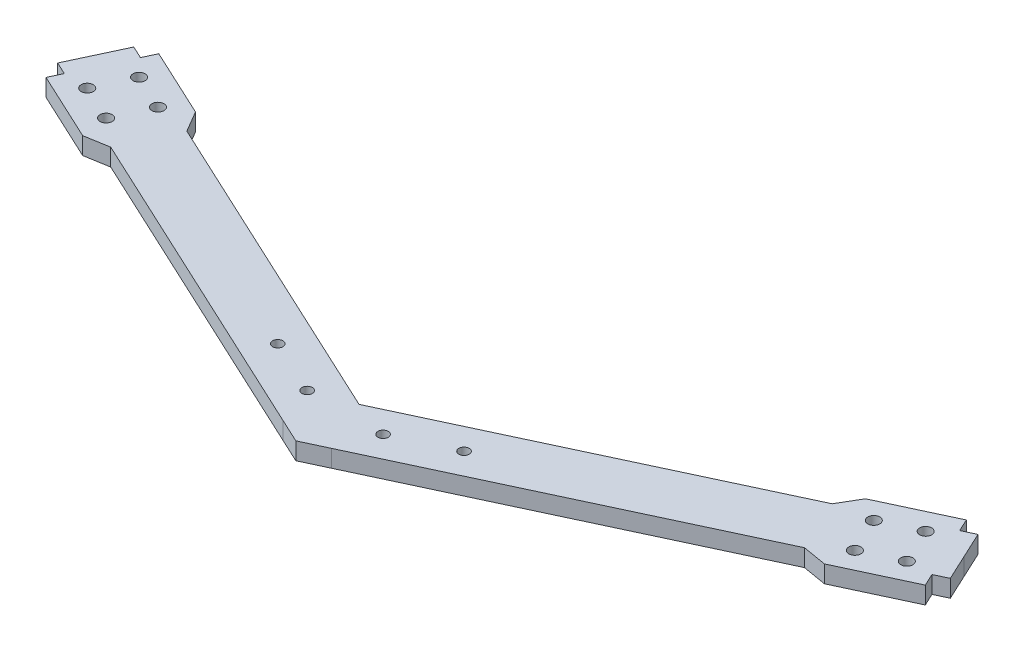
from build123d import *

# Parameters (mm, degrees)
BOSS_EXTRUDE1_DEPTH = 2.5
SKETCH2_R           = 1.5
CUT_EXTRUDE1_DEPTH  = 151.793609014
SKETCH3_R           = 1.75
CUT_EXTRUDE2_DEPTH  = 151.793609014


with BuildPart() as part:
    # Sketch1 → Boss-Extrude1 (new, symmetric)
    with BuildSketch(Plane(origin=(0, 0, 0), x_dir=(1, 0, 0), z_dir=(0, 1, 0))):
        Polygon((0, 18.32), (-93.530963622, 61.934204612), (-97.099562891, 68.014303234), (-117.038334206, 77.311904992), (-118.728807253, 73.686673844), (-122.354038401, 75.377146891), (-125.861769973, 67.854792259), (-129.369941895, 60.33264298), (-125.744809712, 58.641957717), (-127.435494976, 55.016825534), (-107.497267972, 45.718056586), (-100.545722072, 46.892156069), (-7.017311764, 3.272476275), (0, 0), (7.017311764, 3.272476275), (100.545722072, 46.892156069), (107.497267972, 45.718056586), (127.435494976, 55.016825534), (125.744809712, 58.641957717), (129.369941895, 60.33264298), (125.861769973, 67.854792259), (122.354038401, 75.377146891), (118.728807253, 73.686673844), (117.038334206, 77.311904992), (97.099562891, 68.014303234), (93.530963622, 61.934204612), align=None)
    extrude(amount=BOSS_EXTRUDE1_DEPTH, both=True)

    # Sketch2 → Cut-Extrude1 (cut, through all)
    with BuildSketch(Plane(origin=(0, 2.5, 0), x_dir=(1, 0, 0), z_dir=(0, 1, 0))):
        with Locations(Location((-11, 14.291347512, 0), (0, 0, 270))):
            Circle(SKETCH2_R)
        with Locations(Location((11, 14.291347512, 0), (0, 0, 270))):
            Circle(SKETCH2_R)
        with Locations(Location((-27, 21.752270043, 0), (0, 0, 270))):
            Circle(SKETCH2_R)
        with Locations(Location((27, 21.752270043, 0), (0, 0, 90))):
            Circle(SKETCH2_R)
    extrude(amount=-CUT_EXTRUDE1_DEPTH, mode=Mode.SUBTRACT)

    # Sketch3 → Cut-Extrude2 (cut, through all)
    with BuildSketch(Plane(origin=(0, 2.5, 0), x_dir=(1, 0, 0), z_dir=(0, 1, 0))):
        with Locations(Location((-114.001493892, 68.562429851, 0), (0, 0, 270))):
            Circle(SKETCH3_R)
        with Locations(Location((-118.780213306, 58.314432997, 0), (0, 0, 270))):
            Circle(SKETCH3_R)
        with Locations(Location((-103.742089693, 63.778391104, 0), (0, 0, 270))):
            Circle(SKETCH3_R)
        with Locations(Location((-108.521689093, 53.530073465, 0), (0, 0, 270))):
            Circle(SKETCH3_R)
        with Locations(Location((103.742089693, 63.778391104, 0), (0, 0, 90))):
            Circle(SKETCH3_R)
        with Locations(Location((108.521689093, 53.530073465, 0), (0, 0, 90))):
            Circle(SKETCH3_R)
        with Locations(Location((118.780213306, 58.314432997, 0), (0, 0, 90))):
            Circle(SKETCH3_R)
        with Locations(Location((114.001493892, 68.562429851, 0), (0, 0, 90))):
            Circle(SKETCH3_R)
    extrude(amount=-CUT_EXTRUDE2_DEPTH, mode=Mode.SUBTRACT)


solid = part.part
